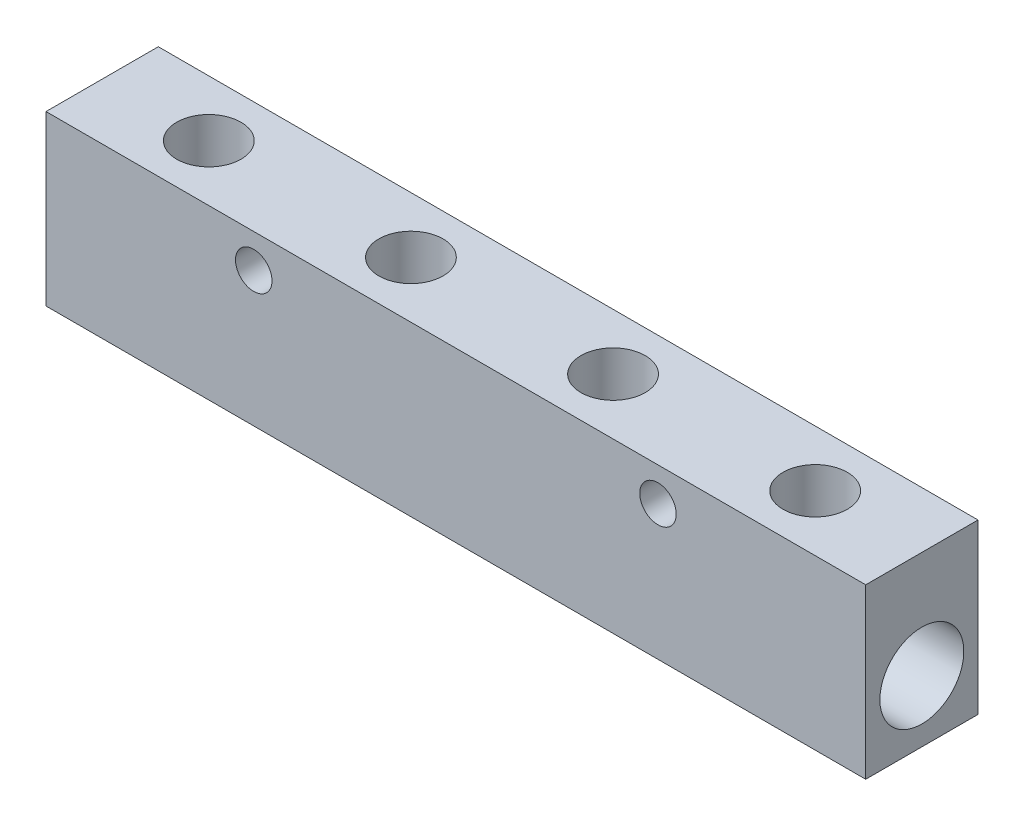
from build123d import *

# Parameters (mm, degrees)
SKETCH1_W           = 146
SKETCH1_H           = 20
BOSS_EXTRUDE1_DEPTH = 30
SKETCH2_R           = 3.25
CUT_EXTRUDE1_DEPTH  = 30
SKETCH3_R           = 7.475
CUT_EXTRUDE2_DEPTH  = 150.385407587
SKETCH4_R           = 5.7225
CUT_EXTRUDE3_DEPTH  = 15


with BuildPart() as part:
    # Sketch1 → Boss-Extrude1 (new body)
    with BuildSketch(Plane(origin=(0, 0, 0), x_dir=(1, 0, 0), z_dir=(0, 1, 0))):
        Rectangle(SKETCH1_W, SKETCH1_H)
    extrude(amount=BOSS_EXTRUDE1_DEPTH)

    # Sketch2 → Cut-Extrude1 (cut)
    with BuildSketch(Plane.XY.offset(10)):
        with Locations((-36, 24)):
            Circle(SKETCH2_R)
        with Locations((36, 24)):
            Circle(SKETCH2_R)
    extrude(amount=-CUT_EXTRUDE1_DEPTH, mode=Mode.SUBTRACT)

    # Sketch3 → Cut-Extrude2 (cut, through all)
    with BuildSketch(Plane.ZY.offset(73)):
        with Locations((0, 11)):
            Circle(SKETCH3_R)
    extrude(amount=-CUT_EXTRUDE2_DEPTH, mode=Mode.SUBTRACT)

    # Sketch4 → Cut-Extrude3 (cut)
    with BuildSketch(Plane(origin=(0, 30, 0), x_dir=(1, 0, 0), z_dir=(0, 1, 0))):
        with Locations(Location((-54, 0, 0), (0, 0, 270))):
            Circle(SKETCH4_R)
        with Locations(Location((-18, 0, 0), (0, 0, 270))):
            Circle(SKETCH4_R)
        with Locations(Location((18, 0, 0), (0, 0, 270))):
            Circle(SKETCH4_R)
        with Locations(Location((54, 0, 0), (0, 0, 270))):
            Circle(SKETCH4_R)
    extrude(amount=-CUT_EXTRUDE3_DEPTH, mode=Mode.SUBTRACT)


solid = part.part
